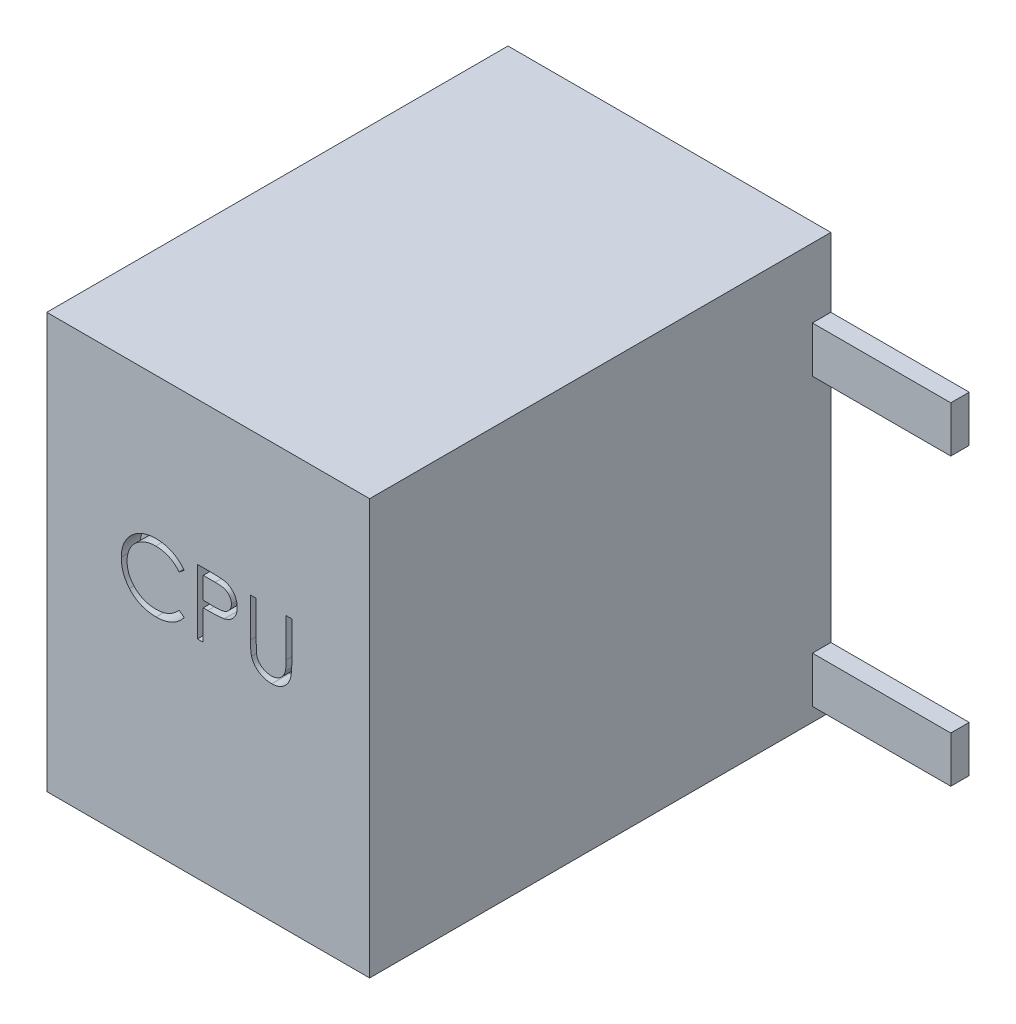
from build123d import *

# Parameters (mm, degrees)
SKETCH1_W           = 17.5
SKETCH1_H           = 22.5
BOSS_EXTRUDE1_DEPTH = 12.5
CUT_EXTRUDE1_DEPTH  = 1
SKETCH3_W           = 2.5
SKETCH3_H           = 7.5
SKETCH3_W_2         = 7.5
SKETCH3_H_2         = 2.5
BOSS_EXTRUDE2_DEPTH = 1


with BuildPart() as part:
    # Sketch1 → Boss-Extrude1 (new, symmetric)
    with BuildSketch(Plane.XY):
        Rectangle(SKETCH1_W, SKETCH1_H)
    extrude(amount=BOSS_EXTRUDE1_DEPTH, both=True)

    # Sketch2 → Cut-Extrude1 (cut)
    # profile 1 of 3: a face of its own
    with BuildSketch(Plane.XY.offset(12.5)):
        with BuildLine():
            Line((-1.301282051, 2.857772436), (-1.576121795, 2.647435897))
            add(Edge.make_bspline(
                [(-1.576121795, 2.647435897), (-1.595727683, 2.670801867), (-1.63467513, 2.717218783), (-1.697334333, 2.782398327), (-1.762635975, 2.843463589), (-1.830555097, 2.900705469), (-1.902314216, 2.952122234), (-1.976175015, 3.000393337), (-2.05337306, 3.043661075), (-2.160124795, 3.096124061), (-2.299772643, 3.150870216), (-2.475567482, 3.196773448), (-2.659078581, 3.225994623), (-2.78427618, 3.229159465), (-2.847956731, 3.230769231)],
                knots=[0, 0, 0, 0, 0.757959112, 1.505699292, 2.245454638, 2.979532153, 3.711538275, 4.438200793, 5.171680507, 5.909471876, 7.393775596, 8.890124382, 10.418191784, 12, 12, 12, 12], degree=3))
            add(Edge.make_bspline(
                [(-2.847956731, 3.230769231), (-2.88304003, 3.230365268), (-2.952881023, 3.229561092), (-3.056529496, 3.218951967), (-3.158242547, 3.204040757), (-3.257954014, 3.181915434), (-3.355536972, 3.153942815), (-3.451629374, 3.120517401), (-3.544839974, 3.079162561), (-3.636458212, 3.033454301), (-3.724237423, 2.981826856), (-3.807292471, 2.925513504), (-3.885320439, 2.865144408), (-3.958383051, 2.800493302), (-4.026554999, 2.731851341), (-4.08934231, 2.658487), (-4.14652772, 2.580634826), (-4.199244745, 2.499321419), (-4.246457479, 2.414783627), (-4.285987358, 2.326708556), (-4.32099248, 2.236604453), (-4.348691723, 2.143453293), (-4.37061624, 2.047910527), (-4.385743903, 1.949719739), (-4.396232374, 1.849086059), (-4.397032551, 1.780876747), (-4.397435897, 1.746494391)],
                knots=[0, 0, 0, 0, 1.054917814, 2.100044995, 3.131103042, 4.146048494, 5.169673617, 6.183595914, 7.203665975, 8.234915748, 9.262203917, 10.264457458, 11.251630812, 12.227803204, 13.197192746, 14.159520551, 15.12972552, 16.100847026, 17.073214652, 18.039054194, 19.002613845, 19.979014051, 20.95965708, 21.949030935, 22.966165397, 24, 24, 24, 24], degree=3))
            add(Edge.make_bspline(
                [(-4.397435897, 1.746494391), (-4.396174078, 1.694763071), (-4.393696664, 1.593195486), (-4.37164833, 1.444424876), (-4.338143239, 1.301904202), (-4.287927662, 1.16652436), (-4.226008611, 1.036616002), (-4.147768, 0.914377148), (-4.057151462, 0.797960584), (-3.952877043, 0.690117636), (-3.838471227, 0.591603911), (-3.715723315, 0.504853329), (-3.584939028, 0.432538447), (-3.447562397, 0.3723625), (-3.302536283, 0.326105772), (-3.150121481, 0.293541649), (-2.990649486, 0.272299468), (-2.881680086, 0.27026578), (-2.826221955, 0.269230769)],
                knots=[0, 0, 0, 0, 1.029171465, 2.020641659, 2.987623507, 3.938342917, 4.889210282, 5.84687017, 6.821220943, 7.821438502, 8.827599549, 9.822697543, 10.807740252, 11.797342354, 12.80366471, 13.83203677, 14.896651826, 16, 16, 16, 16], degree=3))
            add(Edge.make_bspline(
                [(-2.826221955, 0.269230769), (-2.765119266, 0.270919549), (-2.644854557, 0.274243472), (-2.468486531, 0.302402721), (-2.299650765, 0.348060638), (-2.138338179, 0.411958561), (-1.985003532, 0.495023849), (-1.839406872, 0.595721726), (-1.701425302, 0.715010059), (-1.618454019, 0.806093187), (-1.576121795, 0.852564103)],
                knots=[0, 0, 0, 0, 1.028121516, 2.023589091, 2.998037872, 3.967518031, 4.937445131, 5.927275754, 6.942489185, 8, 8, 8, 8], degree=3))
            Line((-1.576121795, 0.852564103), (-1.301282051, 0.644330929))
            add(Edge.make_bspline(
                [(-1.301282051, 0.644330929), (-1.323400161, 0.615792478), (-1.367530436, 0.558852271), (-1.438988453, 0.478580562), (-1.514265751, 0.403076526), (-1.593921461, 0.332948905), (-1.677039252, 0.266794439), (-1.765111565, 0.206492608), (-1.856980597, 0.151201724), (-1.952335076, 0.100574799), (-2.051073689, 0.055657552), (-2.153078124, 0.017203784), (-2.257908699, -0.015921105), (-2.365570208, -0.043173042), (-2.476285965, -0.064444126), (-2.589656439, -0.078663801), (-2.705926314, -0.088405715), (-2.784367735, -0.089293631), (-2.82411859, -0.08974359)],
                knots=[0, 0, 0, 0, 0.986787822, 1.968848986, 2.935600012, 3.899624008, 4.868462664, 5.837806735, 6.815139263, 7.798259679, 8.787526145, 9.778297419, 10.776456485, 11.791383307, 12.812564526, 13.85620153, 14.913611965, 16, 16, 16, 16], degree=3))
            add(Edge.make_bspline(
                [(-2.82411859, -0.08974359), (-2.861762257, -0.089481597), (-2.936197947, -0.088963539), (-3.046096699, -0.080571372), (-3.153086279, -0.069121635), (-3.256860905, -0.051881504), (-3.35798688, -0.031537164), (-3.455547465, -0.004265907), (-3.550502675, 0.026283259), (-3.642471016, 0.062188246), (-3.731530716, 0.102704429), (-3.817394527, 0.148495987), (-3.900022959, 0.199177852), (-3.98022838, 0.253632863), (-4.056825964, 0.313610164), (-4.130479489, 0.378276799), (-4.201601965, 0.44741481), (-4.24560465, 0.497269663), (-4.267728365, 0.522335737)],
                knots=[0, 0, 0, 0, 1.114604814, 2.203992996, 3.262667896, 4.300477797, 5.318619304, 6.316056647, 7.298880507, 8.271930387, 9.238335007, 10.195173496, 11.151986948, 12.108099108, 13.064862484, 14.031167946, 15.010108607, 16, 16, 16, 16], degree=3))
            add(Edge.make_bspline(
                [(-4.267728365, 0.522335737), (-4.303164009, 0.565876926), (-4.373607486, 0.652433637), (-4.463733169, 0.792719618), (-4.540880724, 0.939187827), (-4.603256645, 1.092607755), (-4.652019378, 1.252635143), (-4.685800573, 1.419350657), (-4.707752178, 1.592598599), (-4.710262467, 1.710435388), (-4.711538462, 1.770332532)],
                knots=[0, 0, 0, 0, 0.994628077, 1.977248131, 2.950237994, 3.925870899, 4.908910175, 5.911660606, 6.938484602, 8, 8, 8, 8], degree=3))
            add(Edge.make_bspline(
                [(-4.711538462, 1.770332532), (-4.709983268, 1.833287986), (-4.706923522, 1.95714891), (-4.680927726, 2.138922863), (-4.63910893, 2.313074262), (-4.579712041, 2.479278007), (-4.50440669, 2.638408287), (-4.411380076, 2.789249492), (-4.301712934, 2.932766292), (-4.176265366, 3.066781043), (-4.038698031, 3.189320396), (-3.891379217, 3.297126599), (-3.73459727, 3.386844115), (-3.570079419, 3.461840278), (-3.396593737, 3.519484741), (-3.214510368, 3.559837928), (-3.024171453, 3.584955044), (-2.894309027, 3.588130252), (-2.828325321, 3.58974359)],
                knots=[0, 0, 0, 0, 1.032925535, 2.032216505, 3.007276963, 3.968222605, 4.92396291, 5.891752235, 6.871517503, 7.883894988, 8.900124299, 9.891468569, 10.874487609, 11.85992873, 12.854644235, 13.869047385, 14.917252991, 16, 16, 16, 16], degree=3))
            add(Edge.make_bspline(
                [(-2.828325321, 3.58974359), (-2.788110849, 3.589261452), (-2.708510351, 3.588307108), (-2.590757699, 3.579000965), (-2.476115372, 3.563487359), (-2.36450439, 3.542371289), (-2.255381774, 3.516163968), (-2.149581533, 3.48202367), (-2.046482846, 3.442987138), (-1.946735938, 3.398028672), (-1.850819388, 3.347561931), (-1.758763069, 3.292146307), (-1.67129821, 3.231850502), (-1.587809362, 3.167187326), (-1.509693151, 3.096788767), (-1.434731672, 3.022591171), (-1.365470594, 2.942457347), (-1.322717399, 2.886052413), (-1.301282051, 2.857772436)],
                knots=[0, 0, 0, 0, 1.096760587, 2.17092713, 3.219439832, 4.250915756, 5.268269357, 6.278326846, 7.281116186, 8.274029601, 9.260640565, 10.235837813, 11.203064059, 12.156899882, 13.114053108, 14.069676657, 15.032185724, 16, 16, 16, 16], degree=3))
        make_face()
    # profile 2 of 3: a face of its own
    with BuildSketch(Plane.XY.offset(12.5)):
        with BuildLine():
            Line((-0.583333333, 3.5), (0.103064904, 3.5))
            add(Edge.make_bspline(
                [(0.103064904, 3.5), (0.15027581, 3.499948104), (0.240734003, 3.499848668), (0.370449059, 3.496833922), (0.48825879, 3.49280723), (0.593909171, 3.487225337), (0.687725269, 3.480628747), (0.769282569, 3.471376708), (0.839222125, 3.461716412), (0.881128574, 3.451895005), (0.900240385, 3.447415865)],
                knots=[0, 0, 0, 0, 1.415646017, 2.712440637, 3.8905458, 4.950247383, 5.884950622, 6.709939814, 7.411656543, 8, 8, 8, 8], degree=3))
            add(Edge.make_bspline(
                [(0.900240385, 3.447415865), (0.924433918, 3.440793916), (0.972250896, 3.427706054), (1.041151939, 3.40149233), (1.106705784, 3.370410165), (1.169137343, 3.334986225), (1.227679426, 3.293700661), (1.283205467, 3.248227043), (1.335225447, 3.197515475), (1.383446839, 3.142134735), (1.427731636, 3.083014525), (1.465861319, 3.019272295), (1.497788546, 2.951980992), (1.525171818, 2.881187421), (1.544880272, 2.806297097), (1.559727172, 2.727830385), (1.569150799, 2.645795695), (1.570053361, 2.589735827), (1.570512821, 2.561197917)],
                knots=[0, 0, 0, 0, 0.999701418, 1.975846123, 2.934577507, 3.890451536, 4.834027766, 5.787354733, 6.749476667, 7.726910423, 8.712836071, 9.690891519, 10.682875813, 11.679750201, 12.712814741, 13.765529915, 14.8625177, 16, 16, 16, 16], degree=3))
            add(Edge.make_bspline(
                [(1.570512821, 2.561197917), (1.570091396, 2.53242014), (1.56926685, 2.476114476), (1.559370565, 2.393741688), (1.546040373, 2.315023298), (1.525543321, 2.240133847), (1.498697647, 2.169518077), (1.467205595, 2.102096845), (1.429222064, 2.039017173), (1.385577235, 1.980050055), (1.33702564, 1.925140143), (1.283772702, 1.874685348), (1.226033409, 1.82898101), (1.163991261, 1.787924666), (1.097041413, 1.752468387), (1.026199259, 1.720711082), (0.950849043, 1.694040021), (0.898706529, 1.68000996), (0.872195513, 1.672876603)],
                knots=[0, 0, 0, 0, 1.121902311, 2.195077645, 3.232258892, 4.234102512, 5.217864754, 6.176164875, 7.132989551, 8.084763148, 9.034132444, 9.988522005, 10.94243251, 11.903244335, 12.886203696, 13.894208494, 14.929344452, 16, 16, 16, 16], degree=3))
            add(Edge.make_bspline(
                [(0.872195513, 1.672876603), (0.850268179, 1.668213621), (0.802213151, 1.657994427), (0.723070429, 1.64658597), (0.630925043, 1.63684837), (0.525902763, 1.629547232), (0.408097859, 1.623296864), (0.277446601, 1.61832877), (0.133692524, 1.615598916), (0.03342128, 1.615458123), (-0.018930288, 1.615384615)],
                knots=[0, 0, 0, 0, 0.601384939, 1.31797006, 2.144135048, 3.087295005, 4.142315834, 5.309527816, 6.595305764, 8, 8, 8, 8], degree=3))
            Line((-0.018930288, 1.615384615), (-0.269230769, 1.615384615))
            Line((-0.269230769, 1.615384615), (-0.269230769, 0))
            Line((-0.269230769, 0), (-0.583333333, 0))
            Line((-0.583333333, 0), (-0.583333333, 3.5))
        make_face()
        with BuildLine():
            Line((-0.269230769, 3.141025641), (-0.269230769, 1.974358974))
            Line((-0.269230769, 1.974358974), (0.343549679, 1.966646635))
            add(Edge.make_bspline(
                [(0.343549679, 1.966646635), (0.373469605, 1.966631171), (0.431229405, 1.966601319), (0.514665628, 1.970586542), (0.592074916, 1.975187075), (0.663219491, 1.981922998), (0.728131426, 1.991444256), (0.786918955, 2.001055994), (0.839126237, 2.014961356), (0.900225439, 2.033684426), (0.968308787, 2.065617041), (1.042376335, 2.111966931), (1.105146922, 2.17104764), (1.159465218, 2.237475471), (1.202571096, 2.3113746), (1.234127089, 2.390443537), (1.252668246, 2.473871387), (1.25515444, 2.530959525), (1.256410256, 2.559795673)],
                knots=[0, 0, 0, 0, 1.160613943, 2.240541288, 3.23993089, 4.169200891, 5.011653406, 5.7853311, 6.478053781, 7.106038997, 8.262395093, 9.384106736, 10.481365981, 11.59014053, 12.70357646, 13.786202915, 14.881775077, 16, 16, 16, 16], degree=3))
            add(Edge.make_bspline(
                [(1.256410256, 2.559795673), (1.25514761, 2.587934187), (1.252637625, 2.643870069), (1.233981762, 2.725848829), (1.202632448, 2.804084534), (1.159175853, 2.877057619), (1.106434723, 2.943246423), (1.04513538, 3.00074355), (0.975422119, 3.046965253), (0.910573888, 3.076798534), (0.852972702, 3.09501381), (0.802940742, 3.10775865), (0.746450068, 3.117934257), (0.683482288, 3.126173759), (0.614525454, 3.133227221), (0.538987139, 3.138013198), (0.457153496, 3.140814654), (0.400342925, 3.140953609), (0.370893429, 3.141025641)],
                knots=[0, 0, 0, 0, 1.120700087, 2.227813068, 3.331159281, 4.466773991, 5.599788987, 6.693661531, 7.80175334, 8.91857717, 9.525282508, 10.207424825, 10.974604443, 11.810962634, 12.737642355, 13.736264703, 14.826523623, 16, 16, 16, 16], degree=3))
            Line((0.370893429, 3.141025641), (-0.269230769, 3.141025641))
        make_face(mode=Mode.SUBTRACT)
    # profile 3 of 3: a face of its own
    with BuildSketch(Plane.XY.offset(12.5)):
        with BuildLine():
            Line((2.288461538, 3.5), (2.602564103, 3.5))
            Line((2.602564103, 3.5), (2.602564103, 1.402944712))
            add(Edge.make_bspline(
                [(2.602564103, 1.402944712), (2.602517359, 1.373263976), (2.602428654, 1.316939665), (2.603021168, 1.236771364), (2.604680536, 1.165498905), (2.605726696, 1.102847558), (2.608054029, 1.04910481), (2.609952076, 1.0039795), (2.612392633, 0.967685297), (2.61532575, 0.946504371), (2.616586538, 0.93739984)],
                knots=[0, 0, 0, 0, 1.528628734, 2.90083645, 4.128790002, 5.200304208, 6.127813768, 6.898992206, 7.526736466, 8, 8, 8, 8], degree=3))
            add(Edge.make_bspline(
                [(2.616586538, 0.93739984), (2.621763997, 0.904553076), (2.631827184, 0.840710347), (2.657473561, 0.749802065), (2.693291062, 0.667870607), (2.735734105, 0.592359316), (2.791666716, 0.525369956), (2.858670252, 0.463658303), (2.93984802, 0.409686499), (3.030108626, 0.360335687), (3.127393863, 0.320670604), (3.22680513, 0.29067724), (3.326848109, 0.27239834), (3.393824274, 0.270281801), (3.427083333, 0.269230769)],
                knots=[0, 0, 0, 0, 1.035780045, 2.013197591, 2.933192213, 3.817615948, 4.702609284, 5.640816605, 6.646850145, 7.73207398, 8.84249596, 9.914020372, 10.964143139, 12, 12, 12, 12], degree=3))
            add(Edge.make_bspline(
                [(3.427083333, 0.269230769), (3.455637074, 0.27030462), (3.512579636, 0.272446118), (3.597186066, 0.285707549), (3.679586175, 0.309608115), (3.760186855, 0.340447873), (3.835737839, 0.381195464), (3.906281281, 0.428266303), (3.969245216, 0.48347718), (4.026703213, 0.544577524), (4.076738149, 0.613517324), (4.120109291, 0.688795462), (4.15563522, 0.771544809), (4.173178745, 0.829699231), (4.182191506, 0.859575321)],
                knots=[0, 0, 0, 0, 0.994687771, 1.983630487, 2.973142513, 3.978332533, 4.983357753, 5.956394766, 6.925816176, 7.893390482, 8.871859704, 9.88551698, 10.913711441, 12, 12, 12, 12], degree=3))
            add(Edge.make_bspline(
                [(4.182191506, 0.859575321), (4.185191632, 0.871923895), (4.19187712, 0.899441495), (4.198124165, 0.945962785), (4.20463069, 1.000852149), (4.20914526, 1.064503962), (4.213546481, 1.136704935), (4.216179554, 1.217831192), (4.217396586, 1.307588153), (4.217759267, 1.370225315), (4.217948718, 1.402944712)],
                knots=[0, 0, 0, 0, 0.558680831, 1.244966039, 2.062412453, 2.990489873, 4.051219941, 5.244515665, 6.560634259, 8, 8, 8, 8], degree=3))
            Line((4.217948718, 1.402944712), (4.217948718, 3.5))
            Line((4.217948718, 3.5), (4.532051282, 3.5))
            Line((4.532051282, 3.5), (4.532051282, 1.386117788))
            add(Edge.make_bspline(
                [(4.532051282, 1.386117788), (4.531797162, 1.34801941), (4.53130123, 1.273668107), (4.527000654, 1.164716748), (4.520143654, 1.061363766), (4.510455566, 0.96359527), (4.497618563, 0.871761111), (4.483343342, 0.785056342), (4.465163809, 0.70410335), (4.443930408, 0.628270932), (4.41965686, 0.556085419), (4.388215712, 0.487576804), (4.352791212, 0.420662404), (4.310776559, 0.356354295), (4.263565176, 0.294367742), (4.210113495, 0.235078667), (4.152189335, 0.177539621), (4.088829775, 0.123226555), (4.02107925, 0.073417878), (3.949139292, 0.029620107), (3.873562522, -0.007403511), (3.794545396, -0.037879435), (3.712054193, -0.060794034), (3.626086834, -0.07786919), (3.53644764, -0.087571487), (3.475482984, -0.089013418), (3.444611378, -0.08974359)],
                knots=[0, 0, 0, 0, 1.316592851, 2.569410997, 3.76748051, 4.895814652, 5.963796859, 6.97159953, 7.931736103, 8.829262218, 9.692595152, 10.560224239, 11.431080259, 12.30701507, 13.211635791, 14.121146779, 15.063487852, 16.031507147, 17.00238618, 17.966455255, 18.938106653, 19.907068911, 20.888905087, 21.893141452, 22.933117798, 24, 24, 24, 24], degree=3))
            add(Edge.make_bspline(
                [(3.444611378, -0.08974359), (3.410942276, -0.088958824), (3.344883617, -0.087419118), (3.247545549, -0.078596368), (3.154231353, -0.061977973), (3.063955476, -0.04081803), (2.977946979, -0.011634292), (2.895053535, 0.022463832), (2.816694853, 0.064341093), (2.741599725, 0.110934486), (2.671774969, 0.163359124), (2.607677566, 0.220499298), (2.549201695, 0.281439675), (2.497332999, 0.346840041), (2.451212114, 0.416191748), (2.411481901, 0.489690988), (2.377368657, 0.567309304), (2.359762089, 0.621262504), (2.350861378, 0.64853766)],
                knots=[0, 0, 0, 0, 1.13879206, 2.234305948, 3.301075583, 4.341971843, 5.366689343, 6.369221514, 7.369726634, 8.367512178, 9.355451585, 10.318319045, 11.268648973, 12.207971039, 13.137398894, 14.081662264, 15.030215811, 16, 16, 16, 16], degree=3))
            add(Edge.make_bspline(
                [(2.350861378, 0.64853766), (2.34568422, 0.667170235), (2.334454849, 0.707584704), (2.322429551, 0.774471192), (2.312320469, 0.85148611), (2.302814911, 0.938634728), (2.297205953, 1.035984595), (2.292288514, 1.143493511), (2.288426896, 1.261291472), (2.288449668, 1.343345988), (2.288461538, 1.386117788)],
                knots=[0, 0, 0, 0, 0.625038921, 1.35572334, 2.194682327, 3.136881307, 4.189498639, 5.346923369, 6.617055217, 8, 8, 8, 8], degree=3))
            Line((2.288461538, 1.386117788), (2.288461538, 3.5))
        make_face()
    extrude(amount=-CUT_EXTRUDE1_DEPTH, mode=Mode.SUBTRACT)

    # Sketch3 → Boss-Extrude2 (add)
    with BuildSketch(Plane(origin=(0, 0, -12.5), x_dir=(-1, 0, 0), z_dir=(0, 0, -1))):
        with Locations((0, -15)):
            Rectangle(SKETCH3_W, SKETCH3_H)
        with Locations((-12.5, 6.25)):
            Rectangle(SKETCH3_W_2, SKETCH3_H_2)
        with Locations((-12.5, -9.25)):
            Rectangle(SKETCH3_W_2, SKETCH3_H_2)
    extrude(amount=-BOSS_EXTRUDE2_DEPTH)


solid = part.part
